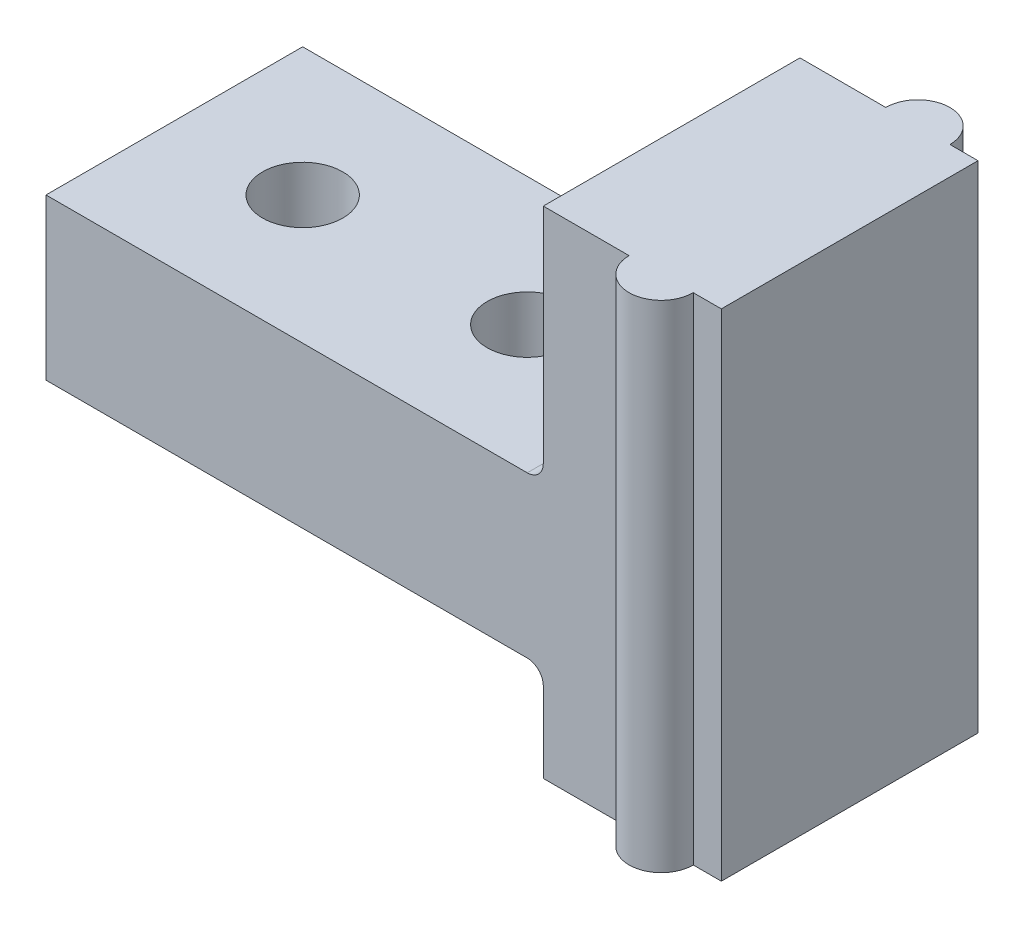
from build123d import *

# Parameters (mm, degrees)
BOSS_EXTRUDE3_DEPTH   = 4
BOSS_EXTRUDE4_DEPTH   = 15.45
M3X0_5_TAPPED_HOLE1_D = 2.5


with BuildPart() as part:
    # Sketch1 → Boss-Extrude3 (new, symmetric)
    with BuildSketch(Plane.XY):
        with BuildLine():
            Line((0, 0), (0, 15.45))
            Line((0, 15.45), (-5.55, 15.45))
            Line((-5.55, 15.45), (-5.55, 8.5))
            ThreePointArc((-5.55, 8.5), (-5.696446609, 8.146446609), (-6.05, 8))
            Line((-6.05, 8), (-21.05, 8))
            Line((-21.05, 8), (-21.05, 3))
            Line((-21.05, 3), (-6.05, 3))
            ThreePointArc((-6.05, 3), (-5.696446609, 2.853553391), (-5.55, 2.5))
            Line((-5.55, 2.5), (-5.55, 0))
            Line((-5.55, 0), (0, 0))
        make_face()
    extrude(amount=BOSS_EXTRUDE3_DEPTH, both=True)

    # Sketch2 → Boss-Extrude4 (add)
    with BuildSketch(Plane.XZ):
        with BuildLine():
            Line((-0.875, 4), (-2.875, 4))
            ThreePointArc((-2.875, 4), (-1.875, 5), (-0.875, 4))
        make_face()
        with BuildLine():
            Line((-0.875, -4), (-2.875, -4))
            ThreePointArc((-2.875, -4), (-1.875, -5), (-0.875, -4))
        make_face()
    extrude(amount=-BOSS_EXTRUDE4_DEPTH)

    # M3x0.5 Tapped Hole1 (through all)
    with Locations(Plane(origin=(0, 3, 0), x_dir=(-1, 0, 0), z_dir=(0, -1, 0))):
        with Locations((17.05, 0), (10.05, 0)):
            Hole(M3X0_5_TAPPED_HOLE1_D / 2)


solid = part.part
